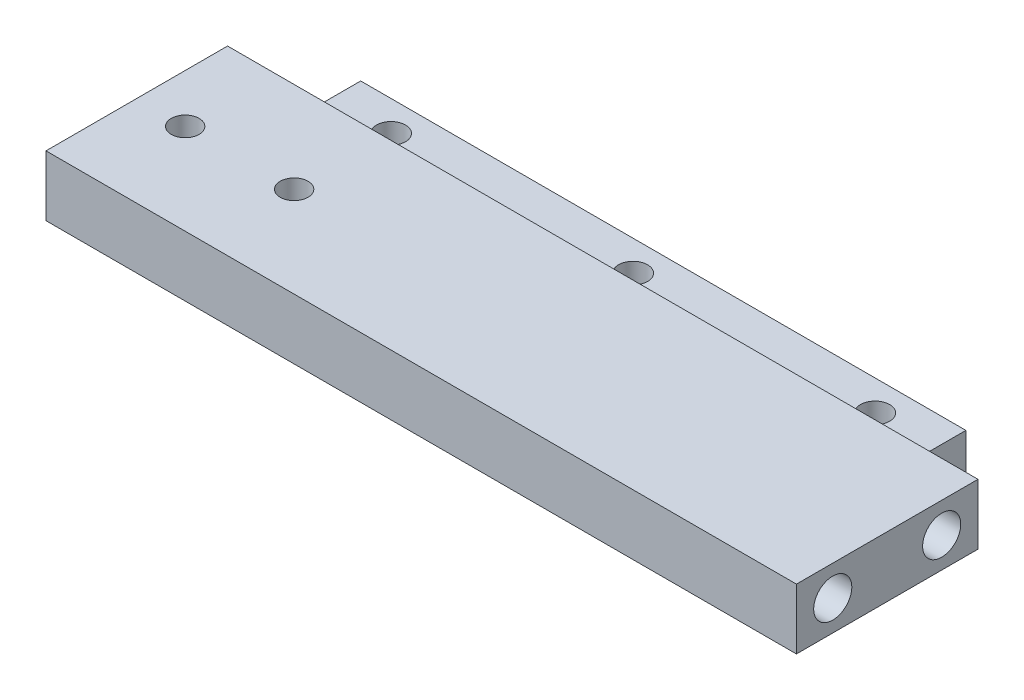
from build123d import *

# Parameters (mm, degrees)
ESBO_O1_W                                            = 62
ESBO_O1_H                                            = 15
RESSALTO_EXTRUS_O1_DEPTH                             = 5
FURO_ROSCADO_PARA_CONDU_TE_DE_M3X0_51_D              = 3.15
FURO_ROSCADO_PARA_CONDU_TE_DE_M3X0_51_DEPTH          = 10
FURO_ROSCADO_PARA_CONDU_TE_DE_M3X0_51_TIP            = 0.946355475
FURO_ROSCADO_PARA_CONDU_TE_DE_M3X0_52_D              = 3.15
FURO_ROSCADO_PARA_CONDU_TE_DE_M3X0_52_DEPTH          = 7.5
FURO_ROSCADO_PARA_CONDU_TE_DE_M3X0_52_TIP            = 0.946355475
FURO_ROSCADO_PARA_CONDU_TE_DE_M2_2X0_451_D           = 2.3
ESBO_O12_W                                           = 50
ESBO_O12_H                                           = 3
RESSALTO_EXTRUS_O2_DEPTH                             = 5
ESCAREADO_PARA_PARAFUSO_DE_M_QUINA_COM_C_D           = 2.4
ESCAREADO_PARA_PARAFUSO_DE_M_QUINA_COM_C_CSINK_D     = 4.4
ESCAREADO_PARA_PARAFUSO_DE_M_QUINA_COM_C_CSINK_ANGLE = 90


with BuildPart() as part:
    # Esboço1 → Ressalto-extrusão1 (new body)
    with BuildSketch(Plane(origin=(0, 0, 0), x_dir=(1, 0, 0), z_dir=(0, 1, 0))):
        with Locations((31, 7.5)):
            Rectangle(ESBO_O1_W, ESBO_O1_H)
    extrude(amount=RESSALTO_EXTRUS_O1_DEPTH)

    # Furo roscado para conduíte de M3x0.51
    with Locations(Plane.ZY):
        with Locations((-12, 2.5), (-3, 2.5)):
            Hole(FURO_ROSCADO_PARA_CONDU_TE_DE_M3X0_51_D / 2, depth=FURO_ROSCADO_PARA_CONDU_TE_DE_M3X0_51_DEPTH)
            with Locations((0, 0, -(FURO_ROSCADO_PARA_CONDU_TE_DE_M3X0_51_DEPTH + FURO_ROSCADO_PARA_CONDU_TE_DE_M3X0_51_TIP / 2))):  # 118° drill point
                Cone(0, FURO_ROSCADO_PARA_CONDU_TE_DE_M3X0_51_D / 2, FURO_ROSCADO_PARA_CONDU_TE_DE_M3X0_51_TIP, mode=Mode.SUBTRACT)

    # Furo roscado para conduíte de M3x0.52
    with Locations(Plane(origin=(62, 0, 0), x_dir=(0, 0, -1), z_dir=(1, 0, 0))):
        with Locations((3, 2.5), (12, 2.5)):
            Hole(FURO_ROSCADO_PARA_CONDU_TE_DE_M3X0_52_D / 2, depth=FURO_ROSCADO_PARA_CONDU_TE_DE_M3X0_52_DEPTH)
            with Locations((0, 0, -(FURO_ROSCADO_PARA_CONDU_TE_DE_M3X0_52_DEPTH + FURO_ROSCADO_PARA_CONDU_TE_DE_M3X0_52_TIP / 2))):  # 118° drill point
                Cone(0, FURO_ROSCADO_PARA_CONDU_TE_DE_M3X0_52_D / 2, FURO_ROSCADO_PARA_CONDU_TE_DE_M3X0_52_TIP, mode=Mode.SUBTRACT)

    # Furo roscado para conduíte de M2.2x0.451 (through all)
    with Locations(Plane(origin=(0, 0, 0), x_dir=(-1, 0, 0), z_dir=(0, -1, 0))):
        with Locations((-4, 7.5), (-13, 7.5)):
            Hole(FURO_ROSCADO_PARA_CONDU_TE_DE_M2_2X0_451_D / 2)

    # Esboço12 → Ressalto-extrusão2 (add)
    with BuildSketch(Plane(origin=(0, 0, -15), x_dir=(-1, 0, 0), z_dir=(0, 0, -1))):
        with Locations((-31, 1.5)):
            Rectangle(ESBO_O12_W, ESBO_O12_H)
    extrude(amount=RESSALTO_EXTRUS_O2_DEPTH)

    # Escareado para parafuso de máquina com cabeça chata de M21 (through all)
    with Locations(Plane(origin=(0, 0, 0), x_dir=(-1, 0, 0), z_dir=(0, -1, 0))):
        with Locations((-11, 17.5), (-51, 17.5), (-31, 17.5)):
            CounterSinkHole(ESCAREADO_PARA_PARAFUSO_DE_M_QUINA_COM_C_D / 2, ESCAREADO_PARA_PARAFUSO_DE_M_QUINA_COM_C_CSINK_D / 2, counter_sink_angle=ESCAREADO_PARA_PARAFUSO_DE_M_QUINA_COM_C_CSINK_ANGLE)


solid = part.part
